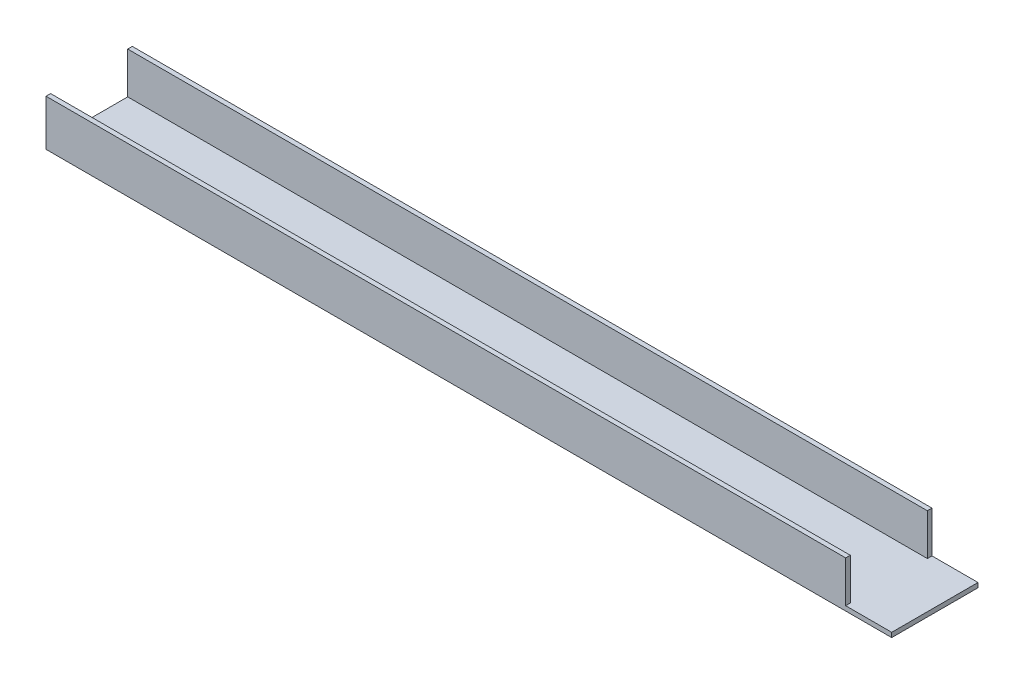
from build123d import *

# Parameters (mm, degrees)
SKETCH_1_W      = 735
SKETCH_1_H      = 75
EXTRUDE_1_DEPTH = 4
SKETCH_2_W      = 695
SKETCH_2_H      = 4
EXTRUDE_2_DEPTH = 36


with BuildPart() as part:
    # 스케치1 → 보스-돌출1 (new body)
    with BuildSketch(Plane(origin=(0, 0, 0), x_dir=(1, 0, 0), z_dir=(0, 1, 0))):
        with Locations((367.5, 37.5)):
            Rectangle(SKETCH_1_W, SKETCH_1_H)
    extrude(amount=EXTRUDE_1_DEPTH)

    # 스케치2 → 보스-돌출2 (add)
    with BuildSketch(Plane(origin=(0, 4, 0), x_dir=(1, 0, 0), z_dir=(0, 1, 0))):
        with Locations((347.5, 2)):
            Rectangle(SKETCH_2_W, SKETCH_2_H)
        with Locations((347.5, 73)):
            Rectangle(SKETCH_2_W, SKETCH_2_H)
    extrude(amount=EXTRUDE_2_DEPTH)


solid = part.part
